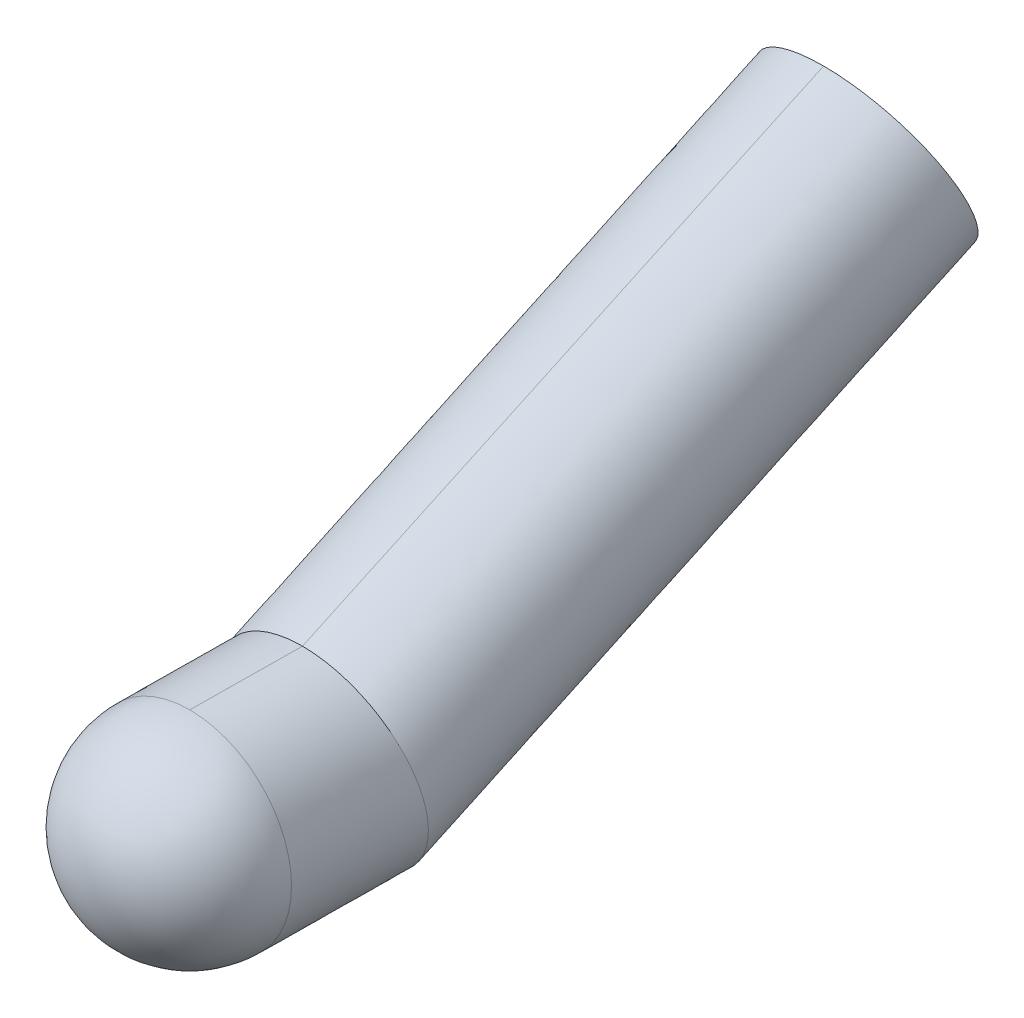
from build123d import *
from build123d.topology import SkipClean

# Parameters (mm, degrees)
CUT_EXTRUDE1_DEPTH = 30


with BuildPart() as part:
    # Sketch1 → Revolve1 (revolve)
    with BuildSketch(Plane.XY):
        with BuildLine():
            Line((0, 5), (0, -5))
            ThreePointArc((0, -5), (5, 0), (0, 5))
        make_face()
    revolve(axis=Axis((0, 5, 0), (0, -1, 0)))

    # Sketch1<2> → Cut-Extrude1 (cut)
    with BuildSketch(Plane.XY):
        with BuildLine():
            Line((0, 5), (0, -5))
            ThreePointArc((0, -5), (5, 0), (0, 5))
        make_face()
    extrude(amount=-CUT_EXTRUDE1_DEPTH, mode=Mode.SUBTRACT)

    # Sweep1: sweep along a path in Sketch3
    with SkipClean():  # the faces are left unmerged after this step: merging them gives an invalid solid
        with BuildLine(Plane(origin=(0, 0, 0), x_dir=(0, 0, -1), z_dir=(1, 0, 0))) as sweep1_path:
            Line((0, 0), (6.618031732, -0.070811638))
            Line((6.618031732, -0.070811638), (33.316828545, 12.321438381))
        # Sketch4 → Sweep1 (sweep)
        with BuildSketch(Plane.XY):
            with BuildLine():
                ThreePointArc((0, 5), (-5, 0), (0, -5))
                ThreePointArc((0, -5), (5, 0), (0, 5))
            make_face()
        sweep(path=sweep1_path.line, transition=Transition.RIGHT)


solid = part.part
